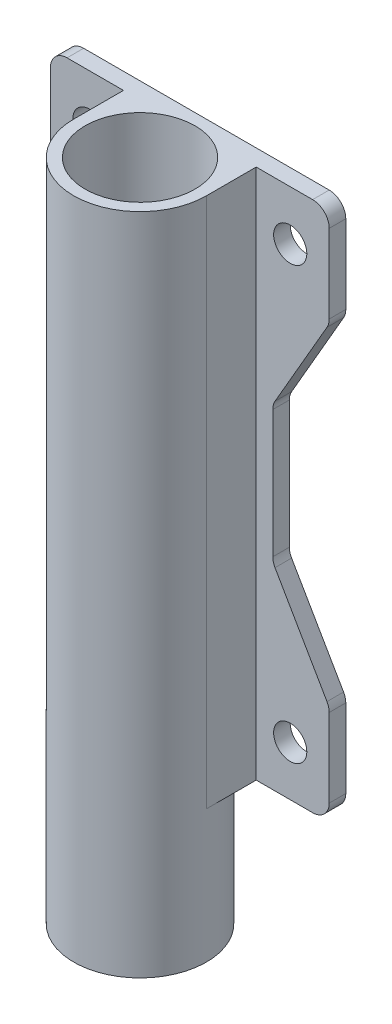
from build123d import *

# Parameters (mm, degrees)
SKETCH2_R           = 6.35
BOSS_EXTRUDE1_DEPTH = 6.35
BOSS_EXTRUDE7_DEPTH = 203.2
BOSS_EXTRUDE8_START = 50.8
SKETCH4_R           = 25.4
BOSS_EXTRUDE8_DEPTH = 50.8
SKETCH5_R           = 21.02866
CUT_EXTRUDE2_DEPTH  = 265.465112255
FILLET1_R           = 6.35


with BuildPart() as part:
    # Sketch2 → Boss-Extrude1 (new body)
    with BuildSketch(Plane.XY):
        Polygon((-53.34, -101.6), (53.34, -101.6), (53.34, -63.5), (31.75, -26.105023065), (31.75, 26.105023065), (53.34, 63.5), (53.34, 101.6), (-53.34, 101.6), (-53.34, 63.5), (-31.75, 26.105023065), (-31.75, -26.105023065), (-53.34, -63.5), align=None)
        with Locations((-38.4175, 82.55)):
            Circle(SKETCH2_R, mode=Mode.SUBTRACT)
        with Locations(Location((-38.4175, -82.55, 0), (0, 0, 180))):
            Circle(SKETCH2_R, mode=Mode.SUBTRACT)
        with Locations((38.4175, -82.55)):
            Circle(SKETCH2_R, mode=Mode.SUBTRACT)
        with Locations(Location((38.4175, 82.55, 0), (0, 0, 180))):
            Circle(SKETCH2_R, mode=Mode.SUBTRACT)
    extrude(amount=BOSS_EXTRUDE1_DEPTH)

    # Sketch3 → Boss-Extrude7 (add)
    with BuildSketch(Plane.XZ.offset(101.6)):
        with BuildLine():
            Line((-25.4, 25.4), (-25.4, 6.35))
            Line((-25.4, 6.35), (-16.800520825, 6.35))
            ThreePointArc((-16.800520825, 6.35), (0, 0), (16.800520825, 6.35))
            Line((16.800520825, 6.35), (25.4, 6.35))
            Line((25.4, 6.35), (25.4, 25.4))
            ThreePointArc((25.4, 25.4), (0, 50.8), (-25.4, 25.4))
        make_face()
    extrude(amount=-BOSS_EXTRUDE7_DEPTH)

    # Sketch4 → Boss-Extrude8 (add)
    with BuildSketch(Plane.XZ.offset(101.6).offset(BOSS_EXTRUDE8_START)):
        with Locations(Location((0, 25.4, 0), (0, 0, 270))):
            Circle(SKETCH4_R)
    extrude(amount=-BOSS_EXTRUDE8_DEPTH)

    # Sketch5 → Cut-Extrude2 (cut, through all)
    with BuildSketch(Plane.XZ.offset(152.4)):
        with Locations(Location((0, 25.4, 0), (0, 0, 270))):
            Circle(SKETCH5_R)
    extrude(amount=-CUT_EXTRUDE2_DEPTH, mode=Mode.SUBTRACT)

    # Fillet1
    fillet1_edges = [part.edges().sort_by_distance(p)[0] for p in [
        (53.34, 63.5, 3.175),
        (31.75, 26.105023065, 3.175),
        (31.75, -26.105023065, 3.175),
        (53.34, -63.5, 3.175),
        (53.34, -101.6, 3.175),
        (-53.34, -101.6, 3.175),
        (-53.34, -63.5, 3.175),
        (-31.75, -26.105023065, 3.175),
        (-31.75, 26.105023065, 3.175),
        (-53.34, 63.5, 3.175),
        (-53.34, 101.6, 3.175),
        (53.34, 101.6, 3.175),
    ]]
    fillet(fillet1_edges, radius=FILLET1_R)


solid = part.part
